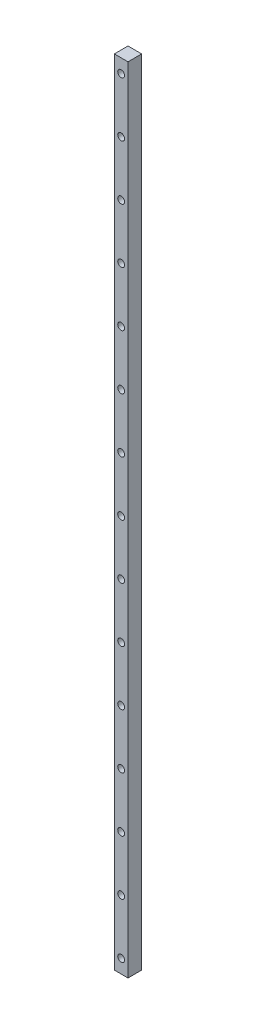
from build123d import *

# Parameters (mm, degrees)
SKETCH_1_W                = 15
SKETCH_1_H                = 15
EXTRUDE_1_DEPTH           = 435
HOLE_WIZARD_1_D           = 4.5
HOLE_WIZARD_1_DEPTH       = 60
HOLE_WIZARD_1_CBORE_D     = 7.5
HOLE_WIZARD_1_CBORE_DEPTH = 5.3
PATTERN_LINEAR_1_COUNT    = 15
PATTERN_LINEAR_1_PITCH    = 60


with BuildPart() as part:
    # 草图1 → 凸台-拉伸1 (new, symmetric)
    with BuildSketch(Plane(origin=(0, 0, 0), x_dir=(1, 0, 0), z_dir=(0, 1, 0))):
        with Locations((0, -7.5)):
            Rectangle(SKETCH_1_W, SKETCH_1_H)
    extrude(amount=EXTRUDE_1_DEPTH, both=True)

    # 孔1
    with Locations(Plane.XY.offset(15)):
        with Locations((0, 420)):
            hole_wizard_1 = CounterBoreHole(HOLE_WIZARD_1_D / 2, HOLE_WIZARD_1_CBORE_D / 2, HOLE_WIZARD_1_CBORE_DEPTH, depth=HOLE_WIZARD_1_DEPTH)

    # 阵列(线性)1: 孔1 ×15
    with Locations(*[(0, -i * PATTERN_LINEAR_1_PITCH, 0) for i in range(1, PATTERN_LINEAR_1_COUNT)]):
        add(hole_wizard_1, mode=Mode.SUBTRACT)


solid = part.part
